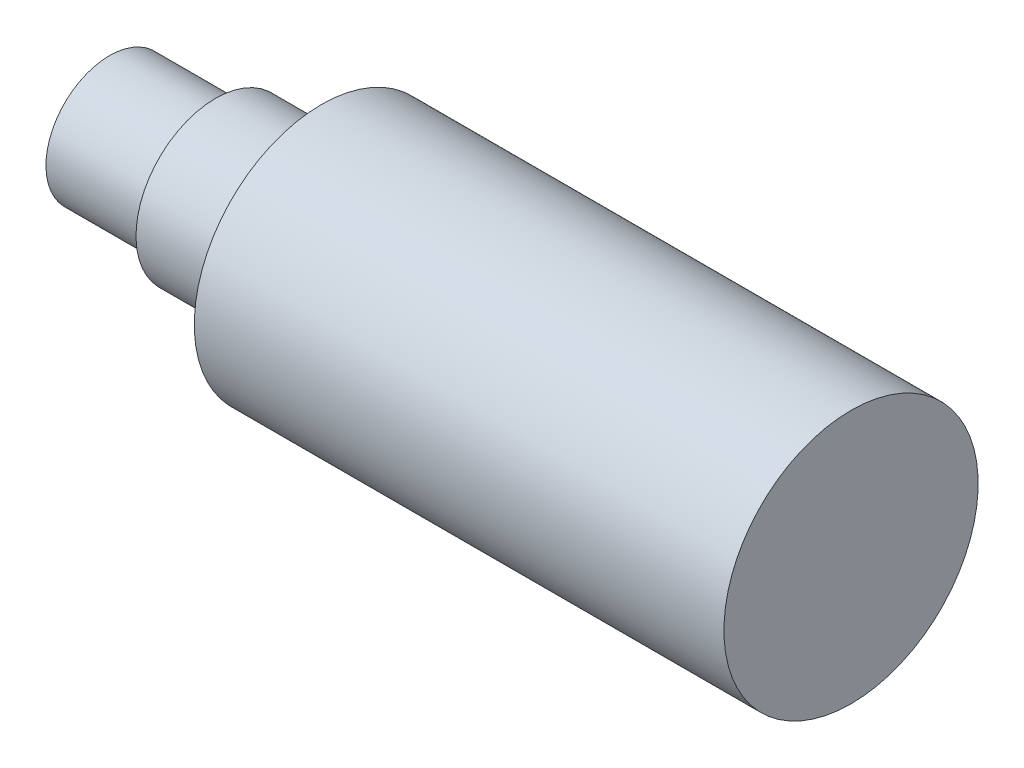
from build123d import *


with BuildPart() as part:
    # Sketch1 → Revolve1 (revolve)
    with BuildSketch(Plane.XY):
        Polygon((0, 0), (0, 6), (10, 6), (10, 7.5), (20, 7.5), (20, 12), (70, 12), (70, 0), align=None)
    revolve(axis=Axis((70, 0, 0), (-1, 0, 0)))


solid = part.part
